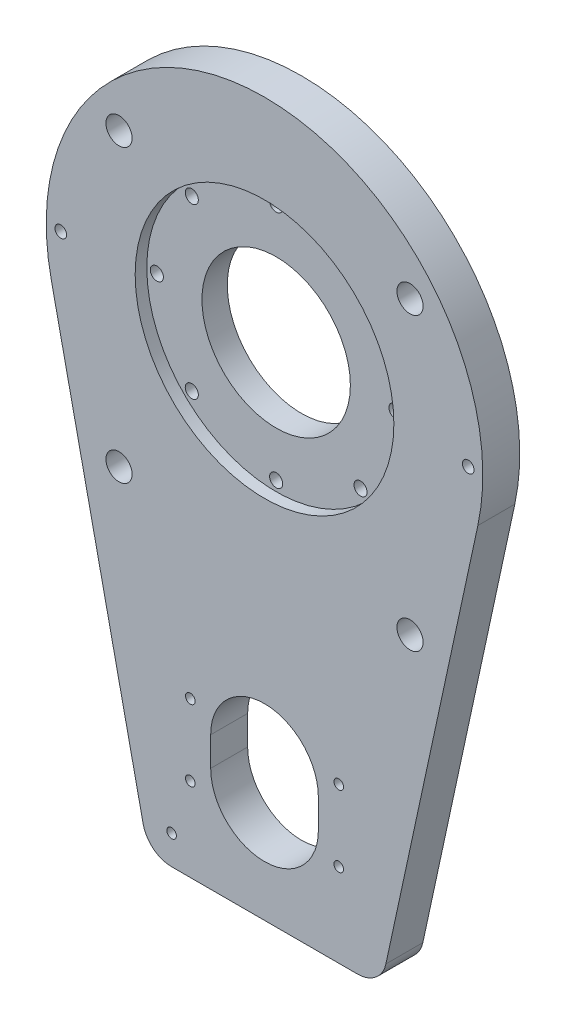
from build123d import *

# Parameters (mm, degrees)
BOSS_EXTRUDE1_DEPTH                                 = 12.7
CUT_EXTRUDE1_DEPTH                                  = 187.242556898
HOLE1_D                                             = 9
F_4_CLEARANCE_HOLE1_D                               = 3.3
HOLE2_D                                             = 51
HOLE2_CBORE_D                                       = 88.9
HOLE2_CBORE_DEPTH                                   = 4
CBORE_FOR_8_BINDING_HEAD_MACHINE_SCREW1_D           = 4.5
CBORE_FOR_8_BINDING_HEAD_MACHINE_SCREW1_DEPTH       = 12.7
CBORE_FOR_8_BINDING_HEAD_MACHINE_SCREW1_CBORE_D     = 8.25
CBORE_FOR_8_BINDING_HEAD_MACHINE_SCREW1_CBORE_DEPTH = 4
FILLET1_R                                           = 10
SKETCH11_R                                          = 2
CUT_EXTRUDE2_DEPTH                                  = 187.242556898


with BuildPart() as part:
    # Sketch1 → Boss-Extrude1 (new body)
    with BuildSketch(Plane.XY.offset(12.7)):
        with BuildLine():
            Line((40, -170), (73.308387301, -15.839202988))
            ThreePointArc((73.308387301, -15.839202988), (0, 75), (-73.308387301, -15.839202988))
            Line((-73.308387301, -15.839202988), (-40, -170))
            Line((-40, -170), (40, -170))
        make_face()
    extrude(amount=-BOSS_EXTRUDE1_DEPTH)

    # Sketch2 → Cut-Extrude1 (cut, through all)
    with BuildSketch(Plane(origin=(0, 0, 0), x_dir=(-1, 0, 0), z_dir=(0, 0, -1))):
        with BuildLine():
            Line((-18.5, -124), (-18.5, -134))
            ThreePointArc((-18.5, -134), (0, -152.5), (18.5, -134))
            Line((18.5, -134), (18.5, -124))
            ThreePointArc((18.5, -124), (0, -105.5), (-18.5, -124))
        make_face()
    extrude(amount=-CUT_EXTRUDE1_DEPTH, mode=Mode.SUBTRACT)

    # Hole1 (through all)
    with Locations(Plane(origin=(0, 0, 0), x_dir=(-1, 0, 0), z_dir=(0, 0, -1))):
        with Locations((-50, -60), (50, -60), (50, 40), (-50, 40)):
            Hole(HOLE1_D / 2)

    # #4 Clearance Hole1 (through all)
    with Locations(Plane.XY.offset(12.7)):
        with Locations((-31.929873349, -160), (-25.5, -116.75), (-25.5, -141.25), (25.5, -116.75), (25.5, -141.25)):
            Hole(F_4_CLEARANCE_HOLE1_D / 2)

    # Hole2 (through all)
    with Locations(Plane.XY.offset(12.7)):
        with Locations((0, 0)):
            CounterBoreHole(HOLE2_D / 2, HOLE2_CBORE_D / 2, HOLE2_CBORE_DEPTH)

    # CBORE for #8 Binding Head Machine Screw1
    with Locations(Plane(origin=(0, 0, 0), x_dir=(-1, 0, 0), z_dir=(0, 0, -1))):
        with Locations((28.991378029, 28.991378029), (41, 0), (28.991378029, -28.991378029), (0, -41), (-28.991378029, -28.991378029), (-41, 0), (-28.991378029, 28.991378029), (0, 41)):
            CounterBoreHole(CBORE_FOR_8_BINDING_HEAD_MACHINE_SCREW1_D / 2, CBORE_FOR_8_BINDING_HEAD_MACHINE_SCREW1_CBORE_D / 2, CBORE_FOR_8_BINDING_HEAD_MACHINE_SCREW1_CBORE_DEPTH, depth=CBORE_FOR_8_BINDING_HEAD_MACHINE_SCREW1_DEPTH)

    # Fillet1
    fillet1_edges = [part.edges().sort_by_distance(p)[0] for p in [
        (-40, -170, 6.35),
        (40, -170, 6.35),
    ]]
    fillet(fillet1_edges, radius=FILLET1_R)

    # Sketch11 → Cut-Extrude2 (cut, through all)
    with BuildSketch(Plane.XY.offset(12.7)):
        with Locations((-70, 0)):
            Circle(SKETCH11_R)
        with Locations((70, 0)):
            Circle(SKETCH11_R)
    extrude(amount=-CUT_EXTRUDE2_DEPTH, mode=Mode.SUBTRACT)


solid = part.part
